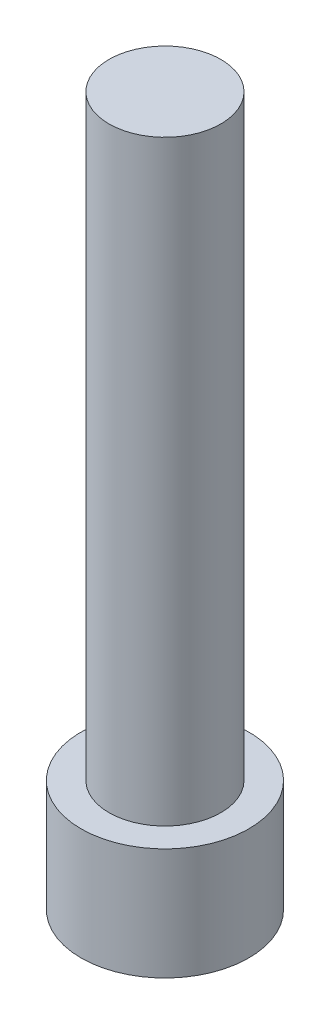
from build123d import *

# Parameters (mm, degrees)
SKETCH_1_R          = 2.25
EXTRUDE_1_DEPTH     = 3
SKETCH_2_R          = 1.5
EXTRUDE_2_DEPTH     = 16
CUT_EXTRUDE_1_DEPTH = 1.5


with BuildPart() as part:
    # 草图1 → 凸台-拉伸1 (new body)
    with BuildSketch(Plane(origin=(0, 0, 0), x_dir=(1, 0, 0), z_dir=(0, 1, 0))):
        with Locations(Location((0, 0, 0), (0, 0, 270))):
            Circle(SKETCH_1_R)
    extrude(amount=EXTRUDE_1_DEPTH)

    # 草图2 → 凸台-拉伸2 (add)
    with BuildSketch(Plane(origin=(0, 3, 0), x_dir=(1, 0, 0), z_dir=(0, 1, 0))):
        with Locations(Location((0, 0, 0), (0, 0, 270))):
            Circle(SKETCH_2_R)
    extrude(amount=EXTRUDE_2_DEPTH)

    # 草图3 → 切除-拉伸1 (cut)
    with BuildSketch(Plane.XZ):
        Polygon((1.091681609, -0.944226984), (1.36356536, 0.473310514), (0.271883751, 1.417537498), (-1.091681609, 0.944226984), (-1.36356536, -0.473310514), (-0.271883751, -1.417537498), align=None)
    extrude(amount=-CUT_EXTRUDE_1_DEPTH, mode=Mode.SUBTRACT)


solid = part.part
